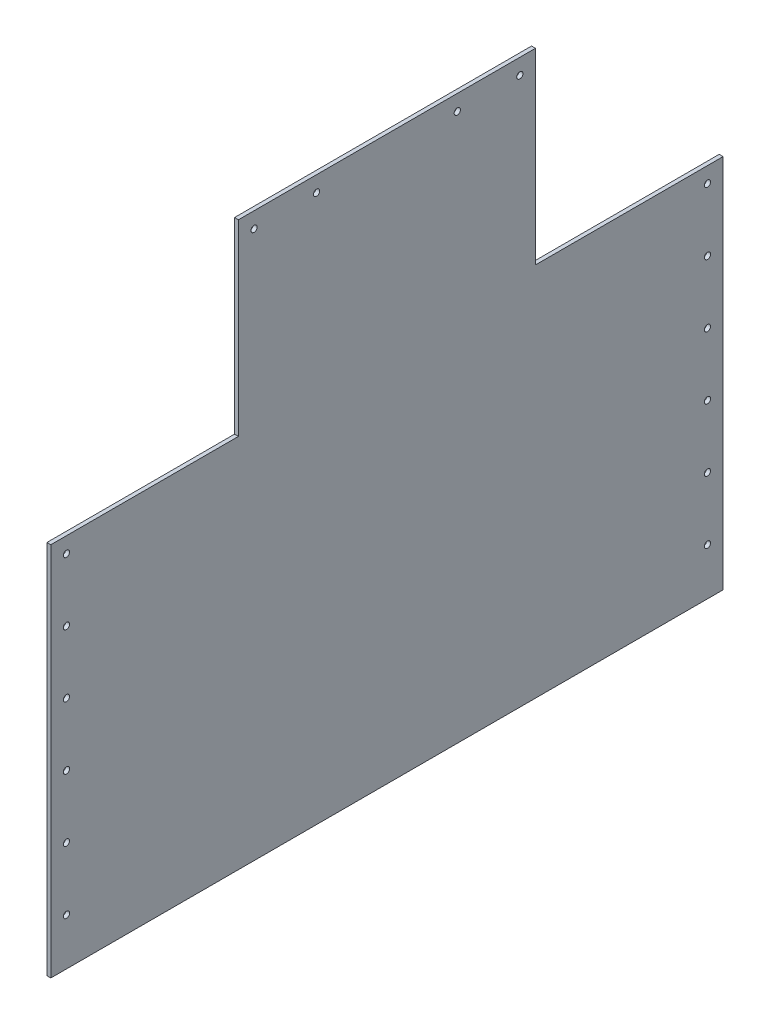
from build123d import *

# Parameters (mm, degrees)
SKETCH1_W           = 546.1
SKETCH1_H           = 457.2
BOSS_EXTRUDE1_DEPTH = 3.175
SKETCH2_R           = 2.54
CUT_EXTRUDE1_DEPTH  = 713.226881425
SKETCH4_W           = 152.4
SKETCH4_H           = 152.4
CUT_EXTRUDE2_DEPTH  = 713.226881425


with BuildPart() as part:
    # Sketch1 → Boss-Extrude1 (new body)
    with BuildSketch(Plane(origin=(0, 0, 0), x_dir=(0, 0, -1), z_dir=(1, 0, 0))):
        with Locations((273.05, 228.6)):
            Rectangle(SKETCH1_W, SKETCH1_H)
    extrude(amount=BOSS_EXTRUDE1_DEPTH)

    # Sketch2 → Cut-Extrude1 (cut, through all)
    with BuildSketch(Plane(origin=(3.175, 0, 0), x_dir=(0, 0, -1), z_dir=(1, 0, 0))):
        with Locations((12.7, 444.5)):
            Circle(SKETCH2_R)
        with Locations((63.5, 444.5)):
            Circle(SKETCH2_R)
        with Locations((114.3, 444.5)):
            Circle(SKETCH2_R)
        with Locations((165.1, 444.5)):
            Circle(SKETCH2_R)
        with Locations((215.9, 444.5)):
            Circle(SKETCH2_R)
        with Locations((12.7, 393.7)):
            Circle(SKETCH2_R)
        with Locations((12.7, 342.9)):
            Circle(SKETCH2_R)
        with Locations((12.7, 292.1)):
            Circle(SKETCH2_R)
        with Locations((12.7, 241.3)):
            Circle(SKETCH2_R)
        with Locations((12.7, 190.5)):
            Circle(SKETCH2_R)
        with Locations((12.7, 139.7)):
            Circle(SKETCH2_R)
        with Locations((12.7, 88.9)):
            Circle(SKETCH2_R)
        with Locations((12.7, 38.1)):
            Circle(SKETCH2_R)
        with Locations(Location((533.4, 38.1, 0), (0, 0, 180))):
            Circle(SKETCH2_R)
        with Locations(Location((533.4, 88.9, 0), (0, 0, 180))):
            Circle(SKETCH2_R)
        with Locations(Location((533.4, 139.7, 0), (0, 0, 180))):
            Circle(SKETCH2_R)
        with Locations(Location((533.4, 190.5, 0), (0, 0, 180))):
            Circle(SKETCH2_R)
        with Locations(Location((533.4, 241.3, 0), (0, 0, 180))):
            Circle(SKETCH2_R)
        with Locations(Location((533.4, 292.1, 0), (0, 0, 180))):
            Circle(SKETCH2_R)
        with Locations(Location((533.4, 342.9, 0), (0, 0, 180))):
            Circle(SKETCH2_R)
        with Locations(Location((533.4, 393.7, 0), (0, 0, 180))):
            Circle(SKETCH2_R)
        with Locations(Location((330.2, 444.5, 0), (0, 0, 180))):
            Circle(SKETCH2_R)
        with Locations(Location((381, 444.5, 0), (0, 0, 180))):
            Circle(SKETCH2_R)
        with Locations(Location((431.8, 444.5, 0), (0, 0, 180))):
            Circle(SKETCH2_R)
        with Locations(Location((482.6, 444.5, 0), (0, 0, 180))):
            Circle(SKETCH2_R)
        with Locations(Location((533.4, 444.5, 0), (0, 0, 180))):
            Circle(SKETCH2_R)
    extrude(amount=-CUT_EXTRUDE1_DEPTH, mode=Mode.SUBTRACT)

    # Sketch4 → Cut-Extrude2 (cut, through all)
    with BuildSketch(Plane(origin=(3.175, 0, 0), x_dir=(0, 0, -1), z_dir=(1, 0, 0))):
        with Locations((76.2, 381)):
            Rectangle(SKETCH4_W, SKETCH4_H)
        with Locations((469.9, 381)):
            Rectangle(SKETCH4_W, SKETCH4_H)
    extrude(amount=-CUT_EXTRUDE2_DEPTH, mode=Mode.SUBTRACT)


solid = part.part
